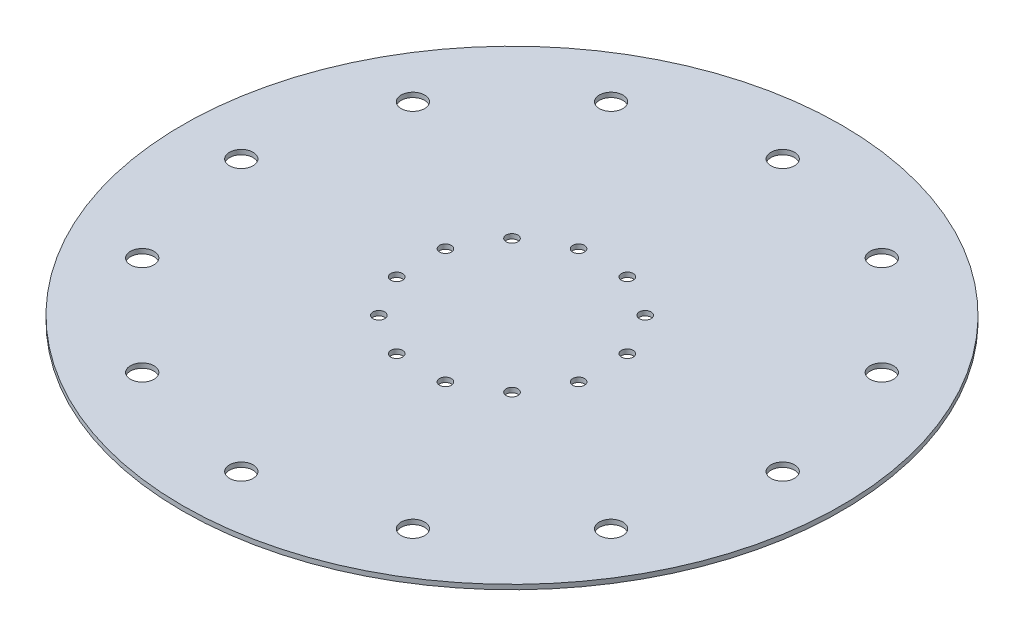
from build123d import *

# Parameters (mm, degrees)
SKETCH1_R           = 140
SKETCH1_R_2         = 5
SKETCH1_R_3         = 2.5
BOSS_EXTRUDE1_DEPTH = 2


with BuildPart() as part:
    # Sketch1 → Boss-Extrude1 (new body)
    with BuildSketch(Plane(origin=(0, 0, 0), x_dir=(1, 0, 0), z_dir=(0, 1, 0))):
        with Locations(Location((0, 0, 0), (0, 0, 270))):
            Circle(SKETCH1_R)
        with Locations(Location((-99.592921435, 57.5, 0), (0, 0, 270))):
            Circle(SKETCH1_R_2, mode=Mode.SUBTRACT)
        with Locations(Location((-57.5, 99.592921435, 0), (0, 0, 270))):
            Circle(SKETCH1_R_2, mode=Mode.SUBTRACT)
        with Locations(Location((57.5, 99.592921435, 0), (0, 0, 90))):
            Circle(SKETCH1_R_2, mode=Mode.SUBTRACT)
        with Locations(Location((99.592921435, 57.5, 0), (0, 0, 90))):
            Circle(SKETCH1_R_2, mode=Mode.SUBTRACT)
        with Locations(Location((99.592921435, -57.5, 0), (0, 0, 270))):
            Circle(SKETCH1_R_2, mode=Mode.SUBTRACT)
        with Locations(Location((57.5, -99.592921435, 0), (0, 0, 270))):
            Circle(SKETCH1_R_2, mode=Mode.SUBTRACT)
        with Locations(Location((-57.5, -99.592921435, 0), (0, 0, 90))):
            Circle(SKETCH1_R_2, mode=Mode.SUBTRACT)
        with Locations(Location((-99.592921435, -57.5, 0), (0, 0, 90))):
            Circle(SKETCH1_R_2, mode=Mode.SUBTRACT)
        with Locations(Location((0, 115, 0), (0, 0, 270))):
            Circle(SKETCH1_R_2, mode=Mode.SUBTRACT)
        with Locations(Location((0, -115, 0), (0, 0, 90))):
            Circle(SKETCH1_R_2, mode=Mode.SUBTRACT)
        with Locations(Location((-115, 0, 0), (0, 0, 270))):
            Circle(SKETCH1_R_2, mode=Mode.SUBTRACT)
        with Locations(Location((115, 0, 0), (0, 0, 90))):
            Circle(SKETCH1_R_2, mode=Mode.SUBTRACT)
        with Locations(Location((-10.352761804, 38.637033052, 0), (0, 0, 270))):
            Circle(SKETCH1_R_3, mode=Mode.SUBTRACT)
        with Locations(Location((-28.284271247, 28.284271247, 0), (0, 0, 270))):
            Circle(SKETCH1_R_3, mode=Mode.SUBTRACT)
        with Locations(Location((-38.637033052, 10.352761804, 0), (0, 0, 270))):
            Circle(SKETCH1_R_3, mode=Mode.SUBTRACT)
        with Locations(Location((-38.637033052, -10.352761804, 0), (0, 0, 270))):
            Circle(SKETCH1_R_3, mode=Mode.SUBTRACT)
        with Locations(Location((38.637033052, -10.352761804, 0), (0, 0, 90))):
            Circle(SKETCH1_R_3, mode=Mode.SUBTRACT)
        with Locations(Location((38.637033052, 10.352761804, 0), (0, 0, 90))):
            Circle(SKETCH1_R_3, mode=Mode.SUBTRACT)
        with Locations(Location((28.284271247, 28.284271247, 0), (0, 0, 90))):
            Circle(SKETCH1_R_3, mode=Mode.SUBTRACT)
        with Locations(Location((10.352761804, 38.637033052, 0), (0, 0, 90))):
            Circle(SKETCH1_R_3, mode=Mode.SUBTRACT)
        with Locations(Location((28.284271247, -28.284271247, 0), (0, 0, 270))):
            Circle(SKETCH1_R_3, mode=Mode.SUBTRACT)
        with Locations(Location((-28.284271247, -28.284271247, 0), (0, 0, 90))):
            Circle(SKETCH1_R_3, mode=Mode.SUBTRACT)
        with Locations(Location((10.352761804, -38.637033052, 0), (0, 0, 270))):
            Circle(SKETCH1_R_3, mode=Mode.SUBTRACT)
        with Locations(Location((-10.352761804, -38.637033052, 0), (0, 0, 90))):
            Circle(SKETCH1_R_3, mode=Mode.SUBTRACT)
    extrude(amount=BOSS_EXTRUDE1_DEPTH)


solid = part.part
